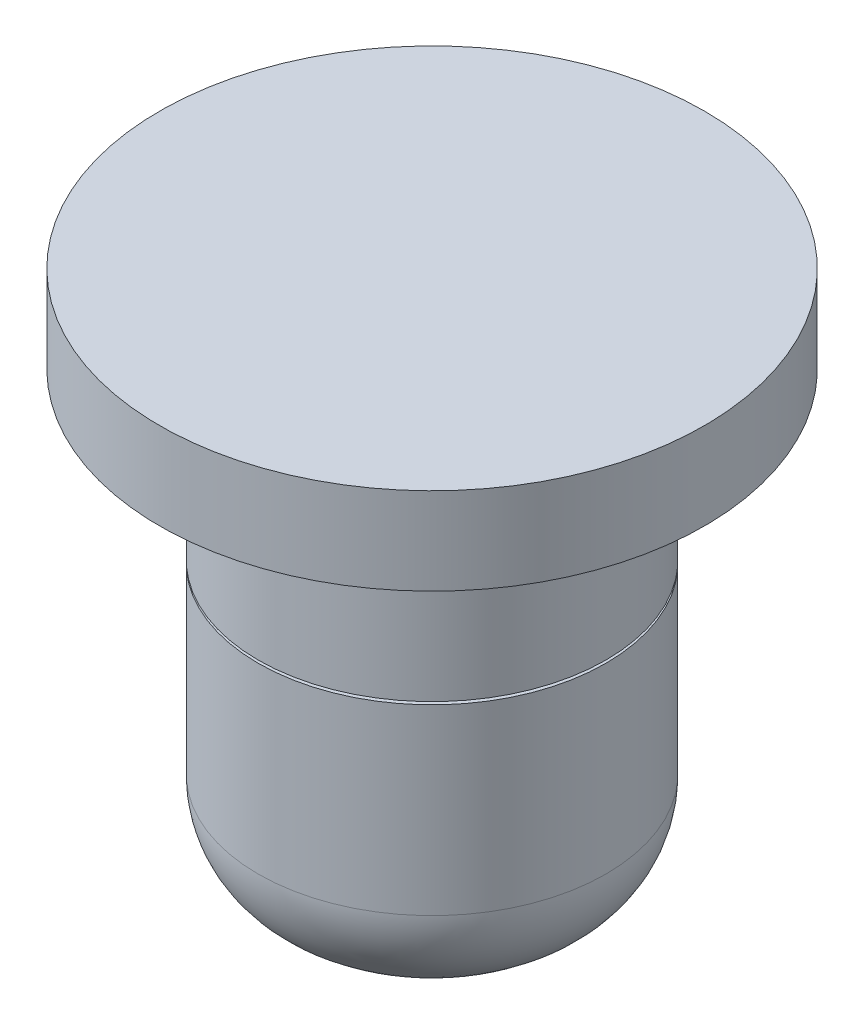
from build123d import *

# Parameters (mm, degrees)
CUT_EXTRUDE1_DEPTH      = 36.083710153
CUT_EXTRUDE1_DEPTH_BACK = 36.083710153
SKETCH2_W               = 72.831256038
SKETCH2_H               = 0.2


with BuildPart() as part:
    # Sketch1 → Revolve1 (revolve)
    with BuildSketch(Plane.XY, mode=Mode.PRIVATE) as revolve1_sk:
        with BuildLine():
            Line((0, 18.626666667), (19.896666667, 18.626666667))
            Line((19.896666667, 18.626666667), (19.896666667, 12.276666667))
            Line((19.896666667, 12.276666667), (12.7, 12.276666667))
            Line((12.7, 12.276666667), (12.7, -13.335))
            ThreePointArc((12.7, -13.335), (10.468153673, -18.723153673), (5.08, -20.955))
            Line((5.08, -20.955), (0, -20.955))
            Line((0, -20.955), (0, 18.626666667))
        make_face()
    revolve(revolve1_sk.sketch.rotate(Axis((0, -20.955, 0), (0, 1, 0)), 90), axis=Axis((0, -20.955, 0), (0, 1, 0)))

    # Sketch2 → Cut-Extrude1 (cut, two sides: drawn at the far end of the back side and taken through both)
    with BuildSketch(Plane.XY.offset(-CUT_EXTRUDE1_DEPTH_BACK)):
        with Locations((0, 0.1)):
            Rectangle(SKETCH2_W, SKETCH2_H)
    extrude(amount=CUT_EXTRUDE1_DEPTH + CUT_EXTRUDE1_DEPTH_BACK, mode=Mode.SUBTRACT)


with BuildPart() as cut_extrude1_piece_1:
    # of the separate pieces the step leaves, piece 1, a body of its own (cut_extrude1_pieces)
    add(part.part.solids().sort_by_distance((0, 12.276666667, -12.7))[0])


with BuildPart() as cut_extrude1_piece_2:
    # of the separate pieces the step leaves, piece 2, a body of its own (cut_extrude1_pieces)
    add(part.part.solids().sort_by_distance((0, -20.955, -5.08))[0])


solid = Compound([cut_extrude1_piece_1.part, cut_extrude1_piece_2.part])
